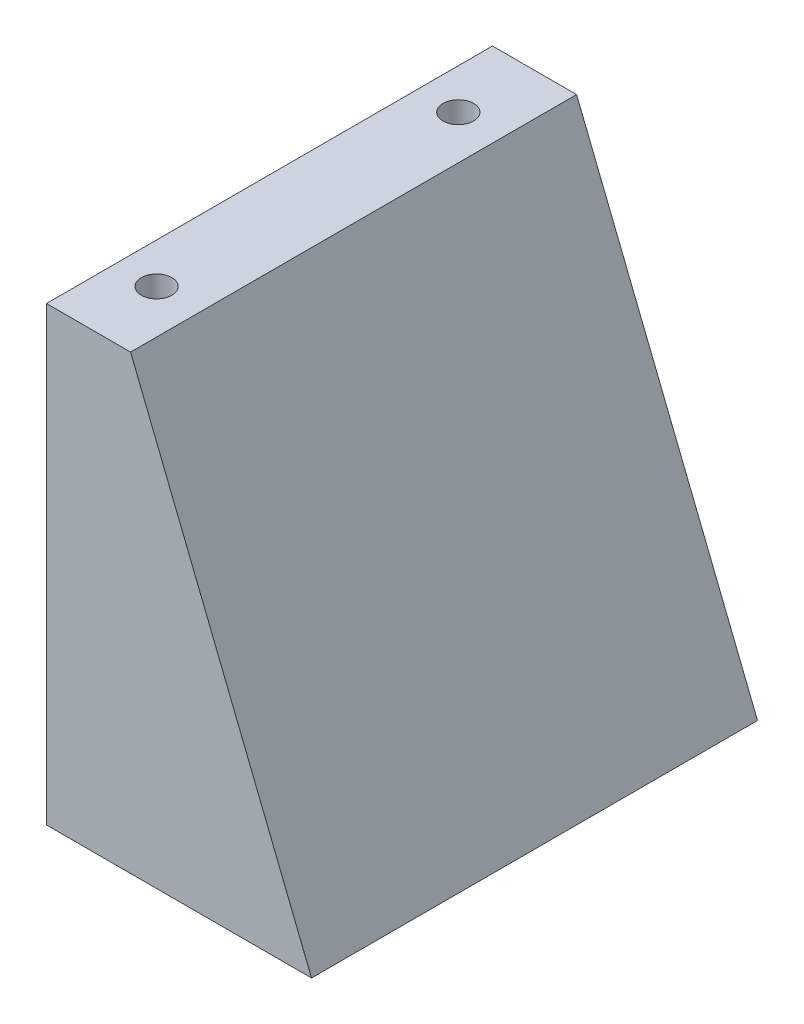
from build123d import *

# Parameters (mm, degrees)
BOSS_EXTRUDE1_DEPTH = 43.75
SKETCH2_R           = 1.6
CUT_EXTRUDE1_DEPTH  = 3
SKETCH3_R           = 1.5
CUT_EXTRUDE2_DEPTH  = 3


with BuildPart() as part:
    # Sketch1 → Boss-Extrude1 (new body)
    with BuildSketch(Plane.XY):
        Polygon((0, 0), (0, 44.3), (8.25, 44.3), (26, 0), align=None)
    extrude(amount=BOSS_EXTRUDE1_DEPTH)

    # Sketch2 → Cut-Extrude1 (cut)
    with BuildSketch(Plane.ZY):
        with Locations((5.875, 38.15)):
            Circle(SKETCH2_R)
        with Locations((37.875, 38.15)):
            Circle(SKETCH2_R)
        with Locations((5.875, 6.15)):
            Circle(SKETCH2_R)
        with Locations((37.875, 6.15)):
            Circle(SKETCH2_R)
    extrude(amount=-CUT_EXTRUDE1_DEPTH, mode=Mode.SUBTRACT)

    # Sketch3 → Cut-Extrude2 (cut)
    with BuildSketch(Plane(origin=(0, 44.3, 0), x_dir=(1, 0, 0), z_dir=(0, 1, 0))):
        with Locations(Location((3.95, -7.3, 0), (0, 0, 270))):
            Circle(SKETCH3_R)
        with Locations(Location((3.95, -36.9, 0), (0, 0, 270))):
            Circle(SKETCH3_R)
    extrude(amount=-CUT_EXTRUDE2_DEPTH, mode=Mode.SUBTRACT)


solid = part.part
